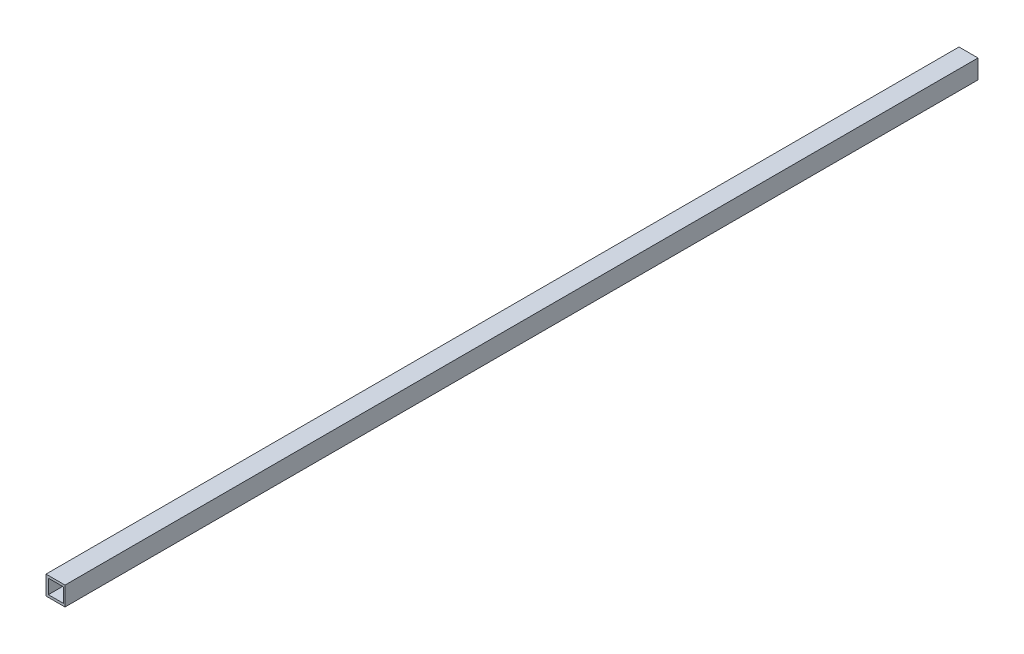
from build123d import *

# Parameters (mm, degrees)
SKETCH1_W           = 25.4
SKETCH1_H           = 25.4
BOSS_EXTRUDE2_DEPTH = 1219.2
SKETCH2_W           = 20.302766191
SKETCH2_H           = 19.05
CUT_EXTRUDE1_DEPTH  = 1220.72905188


with BuildPart() as part:
    # Sketch1 → Boss-Extrude2 (new body)
    with BuildSketch(Plane.XY):
        with Locations((12.7, 12.7)):
            Rectangle(SKETCH1_W, SKETCH1_H)
    extrude(amount=BOSS_EXTRUDE2_DEPTH)

    # Sketch2 → Cut-Extrude1 (cut, through all)
    with BuildSketch(Plane(origin=(0, 0, 0), x_dir=(-1, 0, 0), z_dir=(0, 0, -1))):
        with Locations((-13.326383096, 12.7)):
            Rectangle(SKETCH2_W, SKETCH2_H)
    extrude(amount=-CUT_EXTRUDE1_DEPTH, mode=Mode.SUBTRACT)


solid = part.part
